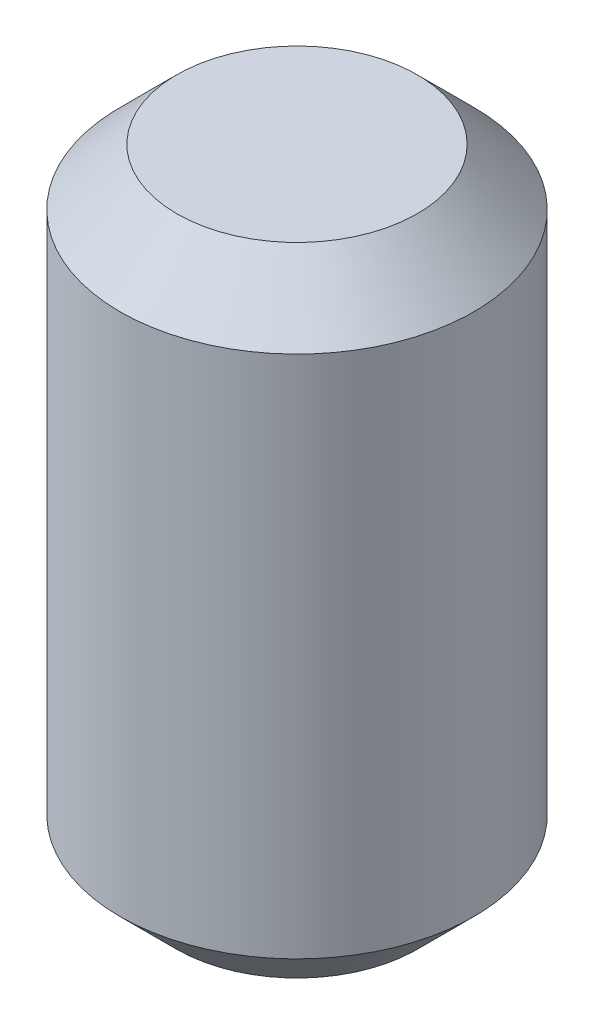
from build123d import *

# Parameters (mm, degrees)
SKETCH1_R           = 2.5
BOSS_EXTRUDE1_DEPTH = 9
CHAMFER1_SIZE       = 0.8


with BuildPart() as part:
    # Sketch1 → Boss-Extrude1 (new body)
    with BuildSketch(Plane(origin=(0, 0, 0), x_dir=(1, 0, 0), z_dir=(0, 1, 0))):
        with Locations(Location((0, 0, 0), (0, 0, 270))):
            Circle(SKETCH1_R)
    extrude(amount=BOSS_EXTRUDE1_DEPTH)

    # Chamfer1
    chamfer1_edges = [part.edges().sort_by_distance(p)[0] for p in [
        (0, 0, -2.5),
        (0, 9, -2.5),
    ]]
    chamfer(chamfer1_edges, length=CHAMFER1_SIZE)


solid = part.part
